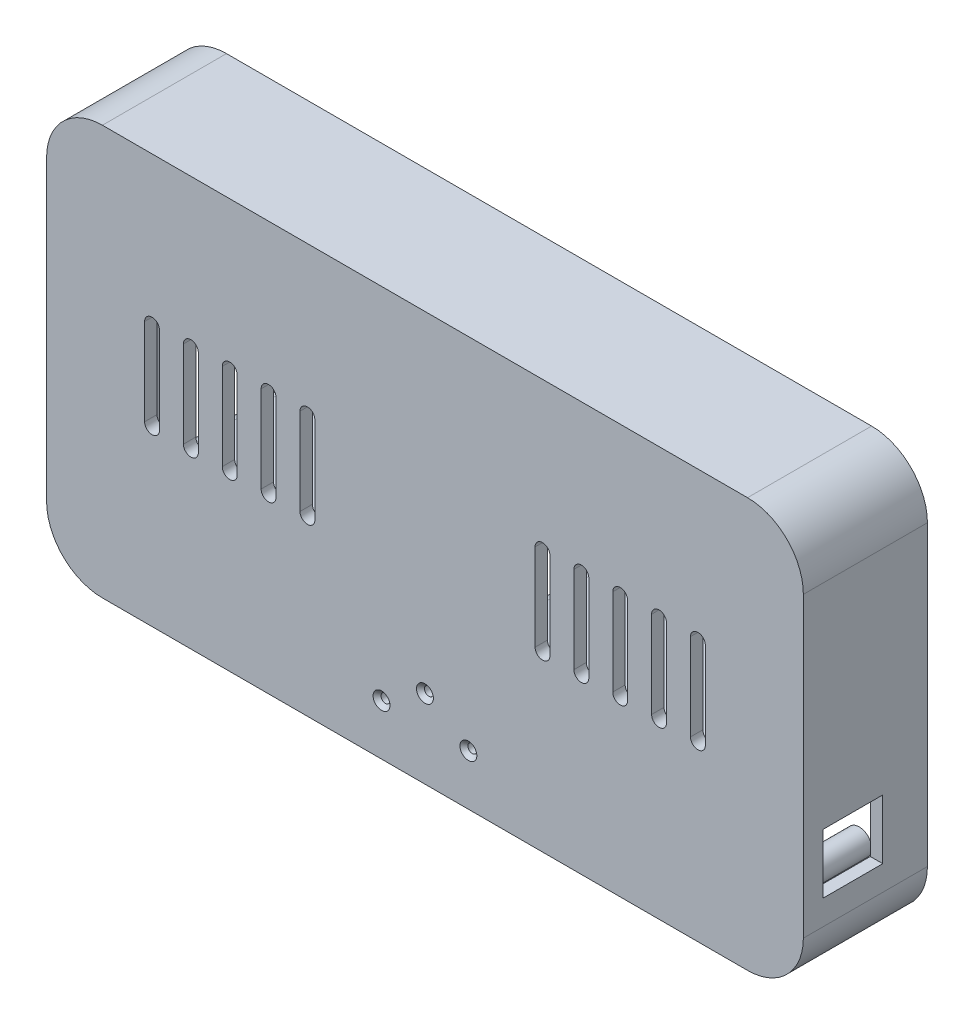
from build123d import *

# Parameters (mm, degrees)
EXTRUDE_1_DEPTH              = 50
SKETCH_1_4_R                 = 5.1
CUT_EXTRUDE_1_DEPTH          = 45
CUT_EXTRUDE_2_DEPTH          = 5
SKETCH_1_6_R                 = 5.1
CUT_EXTRUDE_3_DEPTH          = 5
SKETCH_1_7_R                 = 2.6
CUT_EXTRUDE_4_DEPTH          = 25
SKETCH_14_R                  = 1.6
SKETCH_14_W                  = 14
SKETCH_14_H                  = 9
USB_DEPTH                    = 5
SKETCH_16_W                  = 24
SKETCH_16_H                  = 24
CUT_EXTRUDE_12_DEPTH         = 5
SKETCH_18_W                  = 24
SKETCH_18_H                  = 24
CUT_EXTRUDE_13_DEPTH         = 5
EXTRUDE_2_DEPTH              = 40
SKETCH_29_4_R                = 2.85
SKETCH_29_4_R_2              = 1.15
EXTRUDE_4_DEPTH              = 5
SKETCH_29_5_R                = 3.4
SKETCH_29_5_R_2              = 1.2
EXTRUDE_5_DEPTH              = 6.5
CUT_EXTRUDE_START            = -2
SKETCH_29_R                  = 1.15
SKETCH_29_R_2                = 1.2
CUT_EXTRUDE_14_DEPTH         = 2
SKETCH_30_R                  = 1.6
CUT_EXTRUDE_21_DEPTH         = 5
HOLE_WIZARD_M3_1_D           = 3.6
HOLE_WIZARD_M3_1_CSINK_D     = 6.8
HOLE_WIZARD_M3_1_CSINK_ANGLE = 90
CUT_EXTRUDE_23_REACH         = 181.13


with BuildPart() as part:
    # 草图1 → 凸台-拉伸1 (new body)
    with BuildSketch(Plane.XY):
        with BuildLine():
            Line((-130, 82.5), (130, 82.5))
            ThreePointArc((130, 82.5), (145.909902577, 75.909902577), (152.5, 60))
            Line((152.5, 60), (152.5, -60))
            ThreePointArc((152.5, -60), (145.909902577, -75.909902577), (130, -82.5))
            Line((130, -82.5), (-130, -82.5))
            ThreePointArc((-130, -82.5), (-145.909902577, -75.909902577), (-152.5, -60))
            Line((-152.5, -60), (-152.5, 60))
            ThreePointArc((-152.5, 60), (-145.909902577, 75.909902577), (-130, 82.5))
        make_face()
    extrude(amount=EXTRUDE_1_DEPTH)

    # 草图1<4> → 切除-拉伸1 (cut)
    with BuildSketch(Plane.XY):
        with BuildLine():
            Line((-130, 77.5), (130, 77.5))
            ThreePointArc((130, 77.5), (142.374368671, 72.374368671), (147.5, 60))
            Line((147.5, 60), (147.5, -60))
            ThreePointArc((147.5, -60), (142.374368671, -72.374368671), (130, -77.5))
            Line((130, -77.5), (-130, -77.5))
            ThreePointArc((-130, -77.5), (-142.374368671, -72.374368671), (-147.5, -60))
            Line((-147.5, -60), (-147.5, 60))
            ThreePointArc((-147.5, 60), (-142.374368671, 72.374368671), (-130, 77.5))
        make_face()
        with Locations(Location((130, 60, 0), (0, 0, 180))):
            Circle(SKETCH_1_4_R, mode=Mode.SUBTRACT)
        with Locations(Location((130, -60, 0), (0, 0, 180))):
            Circle(SKETCH_1_4_R, mode=Mode.SUBTRACT)
        with Locations(Location((-130, 60, 0), (0, 0, 180))):
            Circle(SKETCH_1_4_R, mode=Mode.SUBTRACT)
        with Locations(Location((-130, -60, 0), (0, 0, 180))):
            Circle(SKETCH_1_4_R, mode=Mode.SUBTRACT)
    extrude(amount=CUT_EXTRUDE_1_DEPTH, mode=Mode.SUBTRACT)

    # 草图1<5> → 切除-拉伸2 (cut)
    with BuildSketch(Plane.XY):
        with BuildLine():
            ThreePointArc((-150.2, 60), (-144.28355698, 74.28355698), (-130, 80.2))
            Line((-130, 80.2), (130, 80.2))
            ThreePointArc((130, 80.2), (144.28355698, 74.28355698), (150.2, 60))
            Line((150.2, 60), (150.2, -60))
            ThreePointArc((150.2, -60), (144.28355698, -74.28355698), (130, -80.2))
            Line((130, -80.2), (-130, -80.2))
            ThreePointArc((-130, -80.2), (-144.28355698, -74.28355698), (-150.2, -60))
            Line((-150.2, -60), (-150.2, 60))
        make_face()
        with BuildLine():
            Line((-147.5, 60), (-147.5, -60))
            ThreePointArc((-147.5, -60), (-142.374368671, -72.374368671), (-130, -77.5))
            Line((-130, -77.5), (130, -77.5))
            ThreePointArc((130, -77.5), (142.374368671, -72.374368671), (147.5, -60))
            Line((147.5, -60), (147.5, 60))
            ThreePointArc((147.5, 60), (142.374368671, 72.374368671), (130, 77.5))
            Line((130, 77.5), (-130, 77.5))
            ThreePointArc((-130, 77.5), (-142.374368671, 72.374368671), (-147.5, 60))
        make_face(mode=Mode.SUBTRACT)
    extrude(amount=CUT_EXTRUDE_2_DEPTH, mode=Mode.SUBTRACT)

    # 草图1<6> → 切除-拉伸3 (cut)
    with BuildSketch(Plane.XY):
        with Locations(Location((130, 60, 0), (0, 0, 180))):
            Circle(SKETCH_1_6_R)
        with Locations(Location((130, -60, 0), (0, 0, 180))):
            Circle(SKETCH_1_6_R)
        with Locations(Location((-130, 60, 0), (0, 0, 180))):
            Circle(SKETCH_1_6_R)
        with Locations(Location((-130, -60, 0), (0, 0, 180))):
            Circle(SKETCH_1_6_R)
    extrude(amount=CUT_EXTRUDE_3_DEPTH, mode=Mode.SUBTRACT)

    # 草图1<7> → 切除-拉伸4 (cut)
    with BuildSketch(Plane.XY):
        with Locations((-130, -60)):
            Circle(SKETCH_1_7_R)
        with Locations((130, 60)):
            Circle(SKETCH_1_7_R)
        with Locations((130, -60)):
            Circle(SKETCH_1_7_R)
        with Locations((-130, 60)):
            Circle(SKETCH_1_7_R)
    extrude(amount=CUT_EXTRUDE_4_DEPTH, mode=Mode.SUBTRACT)

    # 草图14 → USB口 (cut)
    with BuildSketch(Plane.XZ.offset(82.5)):
        with Locations(Location((-70.9, 38, 0), (0, 0, 270))):
            Circle(SKETCH_14_R)
        with Locations(Location((-89.1, 38, 0), (0, 0, 270))):
            Circle(SKETCH_14_R)
        with Locations((-80, 38)):
            Rectangle(SKETCH_14_W, SKETCH_14_H)
    extrude(amount=-USB_DEPTH, mode=Mode.SUBTRACT)

    # 草图16 → 切除-拉伸12 (cut)
    with BuildSketch(Plane(origin=(152.5, 0, 0), x_dir=(0, 0, -1), z_dir=(1, 0, 0))):
        with Locations((-30, -38)):
            Rectangle(SKETCH_16_W, SKETCH_16_H)
    extrude(amount=-CUT_EXTRUDE_12_DEPTH, mode=Mode.SUBTRACT)

    # 草图18 → 切除-拉伸13 (cut)
    with BuildSketch(Plane.ZY.offset(152.5)):
        with Locations((30, -38)):
            Rectangle(SKETCH_18_W, SKETCH_18_H)
    extrude(amount=-CUT_EXTRUDE_13_DEPTH, mode=Mode.SUBTRACT)

    # 草图19 → 凸台-拉伸2 (add)
    with BuildSketch(Plane(origin=(0, 0, 45), x_dir=(-1, 0, 0), z_dir=(0, 0, -1))):
        with BuildLine():
            Line((-103, 40), (-18, 40))
            ThreePointArc((-18, 40), (-14, 36), (-18, 32))
            Line((-18, 32), (-103, 32))
            ThreePointArc((-103, 32), (-107, 36), (-103, 40))
        make_face()
        with BuildLine():
            Line((103, 40), (18, 40))
            ThreePointArc((18, 40), (14, 36), (18, 32))
            Line((18, 32), (103, 32))
            ThreePointArc((103, 32), (107, 36), (103, 40))
        make_face()
        with BuildLine():
            Line((-103, -20), (-23, -20))
            ThreePointArc((-23, -20), (-19, -24), (-23, -28))
            Line((-23, -28), (-103, -28))
            ThreePointArc((-103, -28), (-107, -24), (-103, -20))
        make_face()
        with BuildLine():
            Line((103, -20), (23, -20))
            ThreePointArc((23, -20), (19, -24), (23, -28))
            Line((23, -28), (103, -28))
            ThreePointArc((103, -28), (107, -24), (103, -20))
        make_face()
    extrude(amount=EXTRUDE_2_DEPTH)

    # 草图29<4> → 凸台-拉伸4 (add)
    # profile 1 of 2: a face of its own
    with BuildSketch(Plane(origin=(0, 0, 45), x_dir=(-1, 0, 0), z_dir=(0, 0, -1))):
        with Locations(Location((-17.5, -31.85, 0), (0, 0, 180))):
            Circle(SKETCH_29_4_R)
        with Locations((-17.5, -31.85)):
            Circle(SKETCH_29_4_R_2, mode=Mode.SUBTRACT)
    # profile 2 of 2: a face of its own
    with BuildSketch(Plane(origin=(0, 0, 45), x_dir=(-1, 0, 0), z_dir=(0, 0, -1))):
        with Locations((17.5, -31.85)):
            Circle(SKETCH_29_4_R)
        with Locations(Location((17.5, -31.85, 0), (0, 0, 180))):
            Circle(SKETCH_29_4_R_2, mode=Mode.SUBTRACT)
    extrude(amount=EXTRUDE_4_DEPTH)

    # 草图29<5> → 凸台-拉伸5 (add)
    # profile 1 of 4: a face of its own
    with BuildSketch(Plane(origin=(0, 0, 45), x_dir=(-1, 0, 0), z_dir=(0, 0, -1))):
        with Locations(Location((-30, 20, 0), (0, 0, 180))):
            Circle(SKETCH_29_5_R)
        with Locations(Location((-30, 20, 0), (0, 0, 180))):
            Circle(SKETCH_29_5_R_2, mode=Mode.SUBTRACT)
    # profile 2 of 4: a face of its own
    with BuildSketch(Plane(origin=(0, 0, 45), x_dir=(-1, 0, 0), z_dir=(0, 0, -1))):
        with Locations(Location((-30, -10, 0), (0, 0, 180))):
            Circle(SKETCH_29_5_R)
        with Locations(Location((-30, -10, 0), (0, 0, 180))):
            Circle(SKETCH_29_5_R_2, mode=Mode.SUBTRACT)
    # profile 3 of 4: a face of its own
    with BuildSketch(Plane(origin=(0, 0, 45), x_dir=(-1, 0, 0), z_dir=(0, 0, -1))):
        with Locations(Location((30, 20, 0), (0, 0, 180))):
            Circle(SKETCH_29_5_R)
        with Locations(Location((30, 20, 0), (0, 0, 180))):
            Circle(SKETCH_29_5_R_2, mode=Mode.SUBTRACT)
    # profile 4 of 4: a face of its own
    with BuildSketch(Plane(origin=(0, 0, 45), x_dir=(-1, 0, 0), z_dir=(0, 0, -1))):
        with Locations(Location((30, -10, 0), (0, 0, 180))):
            Circle(SKETCH_29_5_R)
        with Locations(Location((30, -10, 0), (0, 0, 180))):
            Circle(SKETCH_29_5_R_2, mode=Mode.SUBTRACT)
    extrude(amount=EXTRUDE_5_DEPTH)

    # 草图29 → 切除-拉伸14 (cut)
    with BuildSketch(Plane(origin=(0, 0, 45), x_dir=(-1, 0, 0), z_dir=(0, 0, -1)).offset(CUT_EXTRUDE_START)):
        with Locations((17.5, -31.85)):
            Circle(SKETCH_29_R)
        with Locations((-17.5, -31.85)):
            Circle(SKETCH_29_R)
        with Locations(Location((30, -10, 0), (0, 0, 180))):
            Circle(SKETCH_29_R_2)
        with Locations(Location((-30, -10, 0), (0, 0, 180))):
            Circle(SKETCH_29_R_2)
        with Locations(Location((-30, 20, 0), (0, 0, 180))):
            Circle(SKETCH_29_R_2)
        with Locations(Location((30, 20, 0), (0, 0, 180))):
            Circle(SKETCH_29_R_2)
    extrude(amount=CUT_EXTRUDE_14_DEPTH, mode=Mode.SUBTRACT)

    # 草图30 → 切除-拉伸21 (cut)
    with BuildSketch(Plane(origin=(0, 0, 45), x_dir=(-1, 0, 0), z_dir=(0, 0, -1))):
        with Locations((17.5, -62.0866)):
            Circle(SKETCH_30_R)
        with Locations((0, -50.85)):
            Circle(SKETCH_30_R)
        with Locations((-17.5, -62.0866)):
            Circle(SKETCH_30_R)
    extrude(amount=-CUT_EXTRUDE_21_DEPTH, mode=Mode.SUBTRACT)

    # M3 平头机械螺钉的锥形沉头孔1 (through all)
    with Locations(Plane.XY.offset(50)):
        with Locations((17.5, -62.0866), (0, -50.85), (-17.5, -62.0866)):
            CounterSinkHole(HOLE_WIZARD_M3_1_D / 2, HOLE_WIZARD_M3_1_CSINK_D / 2, counter_sink_angle=HOLE_WIZARD_M3_1_CSINK_ANGLE)

    # 草图38 → 切除-拉伸23 (cut, up to next)
    with BuildSketch(Plane(origin=(0, 0, 45), x_dir=(-1, 0, 0), z_dir=(0, 0, -1)), mode=Mode.PRIVATE) as cut_extrude_23_sk1:
        with BuildLine():
            Line((-107, 22.5), (-107, -12.5))
            ThreePointArc((-107, -12.5), (-110, -15.5), (-113, -12.5))
            Line((-113, -12.5), (-113, 22.5))
            ThreePointArc((-113, 22.5), (-110, 25.5), (-107, 22.5))
        make_face()
    cut_extrude_23_tool1 = extrude(cut_extrude_23_sk1.sketch, amount=-CUT_EXTRUDE_23_REACH, mode=Mode.PRIVATE) & part.part
    # 草图38 → 切除-拉伸23 (cut, up to next)
    with BuildSketch(Plane(origin=(0, 0, 45), x_dir=(-1, 0, 0), z_dir=(0, 0, -1)), mode=Mode.PRIVATE) as cut_extrude_23_sk2:
        with BuildLine():
            Line((-97.343565249, 22.5), (-97.343565249, -12.5))
            ThreePointArc((-97.343565249, -12.5), (-94.343565249, -15.5), (-91.343565249, -12.5))
            Line((-91.343565249, -12.5), (-91.343565249, 22.5))
            ThreePointArc((-91.343565249, 22.5), (-94.343565249, 25.5), (-97.343565249, 22.5))
        make_face()
    cut_extrude_23_tool2 = extrude(cut_extrude_23_sk2.sketch, amount=-CUT_EXTRUDE_23_REACH, mode=Mode.PRIVATE) & part.part
    # 草图38 → 切除-拉伸23 (cut, up to next)
    with BuildSketch(Plane(origin=(0, 0, 45), x_dir=(-1, 0, 0), z_dir=(0, 0, -1)), mode=Mode.PRIVATE) as cut_extrude_23_sk3:
        with BuildLine():
            Line((-81.687130498, 22.5), (-81.687130498, -12.5))
            ThreePointArc((-81.687130498, -12.5), (-78.687130498, -15.5), (-75.687130498, -12.5))
            Line((-75.687130498, -12.5), (-75.687130498, 22.5))
            ThreePointArc((-75.687130498, 22.5), (-78.687130498, 25.5), (-81.687130498, 22.5))
        make_face()
    cut_extrude_23_tool3 = extrude(cut_extrude_23_sk3.sketch, amount=-CUT_EXTRUDE_23_REACH, mode=Mode.PRIVATE) & part.part
    # 草图38 → 切除-拉伸23 (cut, up to next)
    with BuildSketch(Plane(origin=(0, 0, 45), x_dir=(-1, 0, 0), z_dir=(0, 0, -1)), mode=Mode.PRIVATE) as cut_extrude_23_sk4:
        with BuildLine():
            Line((-66.030695747, 22.5), (-66.030695747, -12.5))
            ThreePointArc((-66.030695747, -12.5), (-63.030695747, -15.5), (-60.030695747, -12.5))
            Line((-60.030695747, -12.5), (-60.030695747, 22.5))
            ThreePointArc((-60.030695747, 22.5), (-63.030695747, 25.5), (-66.030695747, 22.5))
        make_face()
    cut_extrude_23_tool4 = extrude(cut_extrude_23_sk4.sketch, amount=-CUT_EXTRUDE_23_REACH, mode=Mode.PRIVATE) & part.part
    # 草图38 → 切除-拉伸23 (cut, up to next)
    with BuildSketch(Plane(origin=(0, 0, 45), x_dir=(-1, 0, 0), z_dir=(0, 0, -1)), mode=Mode.PRIVATE) as cut_extrude_23_sk5:
        with BuildLine():
            Line((-50.374260997, 22.5), (-50.374260997, -12.5))
            ThreePointArc((-50.374260997, -12.5), (-47.374260997, -15.5), (-44.374260997, -12.5))
            Line((-44.374260997, -12.5), (-44.374260997, 22.5))
            ThreePointArc((-44.374260997, 22.5), (-47.374260997, 25.5), (-50.374260997, 22.5))
        make_face()
    cut_extrude_23_tool5 = extrude(cut_extrude_23_sk5.sketch, amount=-CUT_EXTRUDE_23_REACH, mode=Mode.PRIVATE) & part.part
    # 草图38 → 切除-拉伸23 (cut, up to next)
    with BuildSketch(Plane(origin=(0, 0, 45), x_dir=(-1, 0, 0), z_dir=(0, 0, -1)), mode=Mode.PRIVATE) as cut_extrude_23_sk6:
        with BuildLine():
            Line((107, 22.5), (107, -12.5))
            ThreePointArc((107, -12.5), (110, -15.5), (113, -12.5))
            Line((113, -12.5), (113, 22.5))
            ThreePointArc((113, 22.5), (110, 25.5), (107, 22.5))
        make_face()
    cut_extrude_23_tool6 = extrude(cut_extrude_23_sk6.sketch, amount=-CUT_EXTRUDE_23_REACH, mode=Mode.PRIVATE) & part.part
    # 草图38 → 切除-拉伸23 (cut, up to next)
    with BuildSketch(Plane(origin=(0, 0, 45), x_dir=(-1, 0, 0), z_dir=(0, 0, -1)), mode=Mode.PRIVATE) as cut_extrude_23_sk7:
        with BuildLine():
            Line((91.343565249, 22.5), (91.343565249, -12.5))
            ThreePointArc((91.343565249, -12.5), (94.343565249, -15.5), (97.343565249, -12.5))
            Line((97.343565249, -12.5), (97.343565249, 22.5))
            ThreePointArc((97.343565249, 22.5), (94.343565249, 25.5), (91.343565249, 22.5))
        make_face()
    cut_extrude_23_tool7 = extrude(cut_extrude_23_sk7.sketch, amount=-CUT_EXTRUDE_23_REACH, mode=Mode.PRIVATE) & part.part
    # 草图38 → 切除-拉伸23 (cut, up to next)
    with BuildSketch(Plane(origin=(0, 0, 45), x_dir=(-1, 0, 0), z_dir=(0, 0, -1)), mode=Mode.PRIVATE) as cut_extrude_23_sk8:
        with BuildLine():
            Line((75.687130498, 22.5), (75.687130498, -12.5))
            ThreePointArc((75.687130498, -12.5), (78.687130498, -15.5), (81.687130498, -12.5))
            Line((81.687130498, -12.5), (81.687130498, 22.5))
            ThreePointArc((81.687130498, 22.5), (78.687130498, 25.5), (75.687130498, 22.5))
        make_face()
    cut_extrude_23_tool8 = extrude(cut_extrude_23_sk8.sketch, amount=-CUT_EXTRUDE_23_REACH, mode=Mode.PRIVATE) & part.part
    # 草图38 → 切除-拉伸23 (cut, up to next)
    with BuildSketch(Plane(origin=(0, 0, 45), x_dir=(-1, 0, 0), z_dir=(0, 0, -1)), mode=Mode.PRIVATE) as cut_extrude_23_sk9:
        with BuildLine():
            Line((60.030695747, 22.5), (60.030695747, -12.5))
            ThreePointArc((60.030695747, -12.5), (63.030695747, -15.5), (66.030695747, -12.5))
            Line((66.030695747, -12.5), (66.030695747, 22.5))
            ThreePointArc((66.030695747, 22.5), (63.030695747, 25.5), (60.030695747, 22.5))
        make_face()
    cut_extrude_23_tool9 = extrude(cut_extrude_23_sk9.sketch, amount=-CUT_EXTRUDE_23_REACH, mode=Mode.PRIVATE) & part.part
    # 草图38 → 切除-拉伸23 (cut, up to next)
    with BuildSketch(Plane(origin=(0, 0, 45), x_dir=(-1, 0, 0), z_dir=(0, 0, -1)), mode=Mode.PRIVATE) as cut_extrude_23_sk10:
        with BuildLine():
            Line((44.374260997, 22.5), (44.374260997, -12.5))
            ThreePointArc((44.374260997, -12.5), (47.374260997, -15.5), (50.374260997, -12.5))
            Line((50.374260997, -12.5), (50.374260997, 22.5))
            ThreePointArc((50.374260997, 22.5), (47.374260997, 25.5), (44.374260997, 22.5))
        make_face()
    cut_extrude_23_tool10 = extrude(cut_extrude_23_sk10.sketch, amount=-CUT_EXTRUDE_23_REACH, mode=Mode.PRIVATE) & part.part
    add(cut_extrude_23_tool1.solids().sort_by_distance((110, 5, 45))[0], mode=Mode.SUBTRACT)
    add(cut_extrude_23_tool2.solids().sort_by_distance((94.343565, 5, 45))[0], mode=Mode.SUBTRACT)
    add(cut_extrude_23_tool3.solids().sort_by_distance((78.68713, 5, 45))[0], mode=Mode.SUBTRACT)
    add(cut_extrude_23_tool4.solids().sort_by_distance((63.030696, 5, 45))[0], mode=Mode.SUBTRACT)
    add(cut_extrude_23_tool5.solids().sort_by_distance((47.374261, 5, 45))[0], mode=Mode.SUBTRACT)
    add(cut_extrude_23_tool6.solids().sort_by_distance((-110, 5, 45))[0], mode=Mode.SUBTRACT)
    add(cut_extrude_23_tool7.solids().sort_by_distance((-94.343565, 5, 45))[0], mode=Mode.SUBTRACT)
    add(cut_extrude_23_tool8.solids().sort_by_distance((-78.68713, 5, 45))[0], mode=Mode.SUBTRACT)
    add(cut_extrude_23_tool9.solids().sort_by_distance((-63.030696, 5, 45))[0], mode=Mode.SUBTRACT)
    add(cut_extrude_23_tool10.solids().sort_by_distance((-47.374261, 5, 45))[0], mode=Mode.SUBTRACT)


solid = part.part
